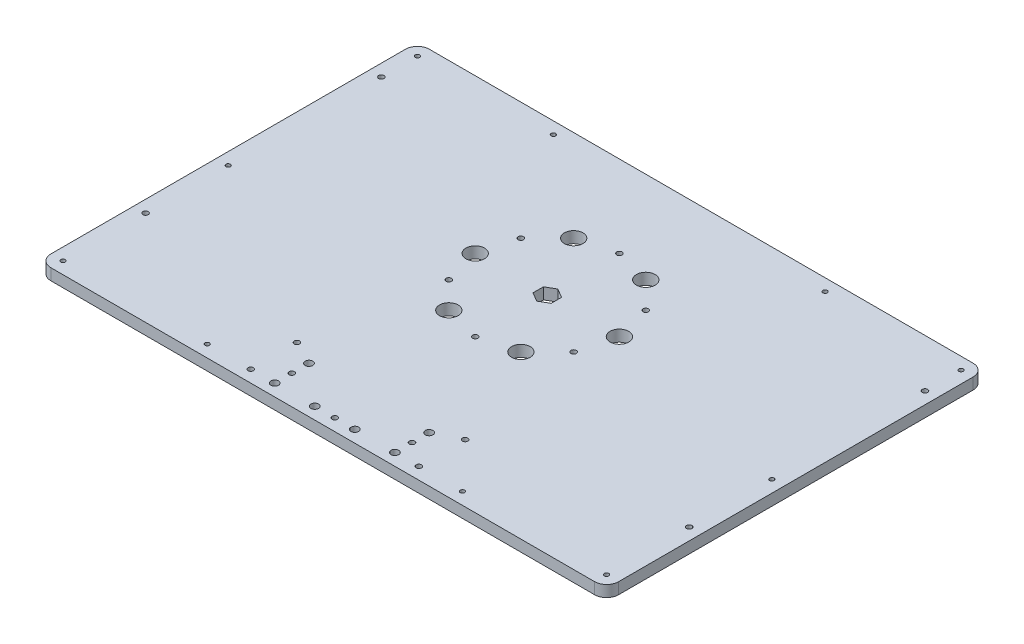
from build123d import *

# Parameters (mm, degrees)
SKETCH1_W            = 300
SKETCH1_H            = 200
BOSS_EXTRUDE1_DEPTH  = 6
SKETCH6_R            = 2.5
CUT_EXTRUDE2_DEPTH   = 361.605047108
FILLET1_R            = 6.35
SKETCH2_R            = 1.5
CUT_EXTRUDE1_DEPTH   = 361.605047108
SKETCH13_R           = 1.25
M3_TAP_DEPTH         = 364.853871767
SKETCH16_R           = 2.1
M5_TAP2_DEPTH        = 358.420816406
SKETCH9_R            = 1.5
CUT_EXTRUDE3_DEPTH   = 361.605047108
SKETCH10_R           = 1.5
CUT_EXTRUDE5_DEPTH   = 361.605047108
SKETCH17_R           = 5
M3_COUNTERBORE_DEPTH = 361.605047108
CUT_EXTRUDE6_DEPTH   = 361.605047108
MOVE_FACE1_BY        = 0.08
MOVE_FACE1_2_BY      = 0.08
MOVE_FACE1_3_BY      = 0.08
MOVE_FACE1_4_BY      = 0.08
MOVE_FACE1_5_BY      = 0.08
MOVE_FACE1_6_BY      = 0.08
MOVE_FACE1_7_BY      = 0.08
MOVE_FACE1_8_BY      = 0.08
MOVE_FACE1_9_BY      = 0.08
MOVE_FACE1_10_BY     = 0.08
MOVE_FACE1_11_BY     = 0.08
MOVE_FACE1_12_BY     = 0.08
MOVE_FACE1_13_BY     = 0.08
MOVE_FACE1_14_BY     = 0.08
MOVE_FACE1_15_BY     = 0.08
MOVE_FACE1_16_BY     = 0.08
MOVE_FACE1_17_BY     = 0.08
MOVE_FACE1_18_BY     = 0.08
MOVE_FACE1_19_BY     = 0.08
MOVE_FACE1_20_BY     = 0.08
MOVE_FACE1_21_BY     = 0.08
MOVE_FACE1_22_BY     = 0.08
MOVE_FACE1_23_BY     = 0.08
MOVE_FACE1_24_BY     = 0.08
MOVE_FACE1_25_BY     = 0.08
MOVE_FACE1_26_BY     = 0.08
MOVE_FACE1_27_BY     = 0.08
MOVE_FACE1_28_BY     = 0.08
MOVE_FACE1_29_BY     = 0.08
MOVE_FACE1_30_BY     = 0.08
MOVE_FACE1_31_BY     = 0.08
MOVE_FACE1_32_BY     = 0.08
MOVE_FACE1_33_BY     = 0.08
MOVE_FACE1_34_BY     = 0.08
MOVE_FACE1_35_BY     = 0.08
MOVE_FACE1_36_BY     = 0.08
MOVE_FACE1_37_BY     = 0.08
MOVE_FACE1_38_BY     = 0.08
MOVE_FACE1_39_BY     = 0.08


with BuildPart() as part:
    # Sketch1 → Boss-Extrude1 (new body)
    with BuildSketch(Plane(origin=(0, 0, 0), x_dir=(1, 0, 0), z_dir=(0, 1, 0))):
        with Locations((150, 100)):
            Rectangle(SKETCH1_W, SKETCH1_H)
    extrude(amount=BOSS_EXTRUDE1_DEPTH)

    # Sketch6 → Cut-Extrude2 (cut, through all)
    with BuildSketch(Plane(origin=(0, 6, 0), x_dir=(1, 0, 0), z_dir=(0, 1, 0))):
        with Locations(Location((150, 118.65102, 0), (0, 0, 270))):
            Circle(SKETCH6_R)
    extrude(amount=-CUT_EXTRUDE2_DEPTH, mode=Mode.SUBTRACT)

    # Fillet1
    fillet1_edges = [part.edges().sort_by_distance(p)[0] for p in [
        (0, 3, -200),
        (300, 3, -200),
        (300, 3, 0),
        (0, 3, 0),
    ]]
    fillet(fillet1_edges, radius=FILLET1_R)

    # Sketch2 → Cut-Extrude1 (cut, through all)
    with BuildSketch(Plane(origin=(0, 6, 0), x_dir=(1, 0, 0), z_dir=(0, 1, 0))):
        with Locations(Location((6.35, 174.6, 0), (0, 0, 270))):
            Circle(SKETCH2_R)
        with Locations(Location((6.35, 49.9999, 0), (0, 0, 270))):
            Circle(SKETCH2_R)
        with Locations(Location((293.65, 49.9999, 0), (0, 0, 270))):
            Circle(SKETCH2_R)
        with Locations(Location((293.65, 174.6, 0), (0, 0, 270))):
            Circle(SKETCH2_R)
    extrude(amount=-CUT_EXTRUDE1_DEPTH, mode=Mode.SUBTRACT)

    # Sketch13 → M3-tap (cut, through all)
    with BuildSketch(Plane(origin=(0, 6, 5.8), x_dir=(1, 0, 0), z_dir=(0, 1, 0))):
        with Locations(Location((6.35, 199.45, 0), (0, 0, 270))):
            Circle(SKETCH13_R)
        with Locations(Location((78.175, 199.45, 0), (0, 0, 270))):
            Circle(SKETCH13_R)
        with Locations(Location((221.825, 199.45, 0), (0, 0, 270))):
            Circle(SKETCH13_R)
        with Locations(Location((293.65, 199.45, 0), (0, 0, 270))):
            Circle(SKETCH13_R)
        with Locations(Location((293.65, 99.4498, 0), (0, 0, 270))):
            Circle(SKETCH13_R)
        with Locations(Location((293.65, 12.15, 0), (0, 0, 270))):
            Circle(SKETCH13_R)
        with Locations(Location((217.45, 12.15, 0), (0, 0, 270))):
            Circle(SKETCH13_R)
        with Locations(Location((82.55, 12.15, 0), (0, 0, 270))):
            Circle(SKETCH13_R)
        with Locations(Location((6.35, 12.15, 0), (0, 0, 270))):
            Circle(SKETCH13_R)
        with Locations(Location((6.35, 99.4498, 0), (0, 0, 270))):
            Circle(SKETCH13_R)
    extrude(amount=-M3_TAP_DEPTH, mode=Mode.SUBTRACT)

    # Sketch16 → M5-tap2 (cut, through all)
    with BuildSketch(Plane(origin=(0, 6, -5.8), x_dir=(1, 0, 0), z_dir=(0, -1, 0))):
        with Locations(Location((118.25, -18.65102, 0), (0, 0, 270))):
            Circle(SKETCH16_R)
        with Locations(Location((118.25, -0.55098, 0), (0, 0, 270))):
            Circle(SKETCH16_R)
        with Locations(Location((139.416666667, -0.55098, 0), (0, 0, 270))):
            Circle(SKETCH16_R)
        with Locations(Location((160.583333333, -0.55098, 0), (0, 0, 270))):
            Circle(SKETCH16_R)
        with Locations(Location((181.75, -0.55098, 0), (0, 0, 270))):
            Circle(SKETCH16_R)
        with Locations(Location((181.75, -18.65102, 0), (0, 0, 270))):
            Circle(SKETCH16_R)
    extrude(amount=M5_TAP2_DEPTH, mode=Mode.SUBTRACT)

    # Sketch9 → Cut-Extrude3 (cut, through all)
    with BuildSketch(Plane(origin=(0, 6, 0), x_dir=(-1, 0, 0), z_dir=(0, 1, 0))):
        with Locations(Location((-118.25, -15.401, 0), (0, 0, 90))):
            Circle(SKETCH9_R)
        with Locations(Location((-150, -6.35098, 0), (0, 0, 90))):
            Circle(SKETCH9_R)
        with Locations(Location((-181.75, -15.401, 0), (0, 0, 90))):
            Circle(SKETCH9_R)
    extrude(amount=-CUT_EXTRUDE3_DEPTH, mode=Mode.SUBTRACT)

    # Sketch10 → Cut-Extrude5 (cut, through all)
    with BuildSketch(Plane(origin=(0, 6, 0), x_dir=(1, 0, 0), z_dir=(0, 1, 0))):
        with Locations(Location((150, 156.75102, 0), (0, 0, 270))):
            Circle(SKETCH10_R)
        with Locations(Location((182.995567884, 137.70102, 0), (0, 0, 270))):
            Circle(SKETCH10_R)
        with Locations(Location((182.995567884, 99.60102, 0), (0, 0, 270))):
            Circle(SKETCH10_R)
        with Locations(Location((150, 80.55102, 0), (0, 0, 270))):
            Circle(SKETCH10_R)
        with Locations(Location((117.004432116, 99.60102, 0), (0, 0, 270))):
            Circle(SKETCH10_R)
        with Locations(Location((117.004432116, 137.70102, 0), (0, 0, 270))):
            Circle(SKETCH10_R)
        with Locations(Location((105.55, 30.80102, 0), (0, 0, 270))):
            Circle(SKETCH10_R)
        with Locations(Location((105.55, 6.35, 0), (0, 0, 270))):
            Circle(SKETCH10_R)
        with Locations(Location((194.45, 6.35, 0), (0, 0, 90))):
            Circle(SKETCH10_R)
        with Locations(Location((194.45, 30.80102, 0), (0, 0, 90))):
            Circle(SKETCH10_R)
    extrude(amount=-CUT_EXTRUDE5_DEPTH, mode=Mode.SUBTRACT)

    # Sketch17 → M3_counterbore (cut, through all)
    with BuildSketch(Plane(origin=(0, 6, 0), x_dir=(1, 0, 0), z_dir=(0, 1, 0))):
        with Locations(Location((188.1, 118.65102, 0), (0, 0, 270))):
            Circle(SKETCH17_R)
        with Locations(Location((169.05, 85.655452116, 0), (0, 0, 270))):
            Circle(SKETCH17_R)
        with Locations(Location((130.95, 85.655452116, 0), (0, 0, 270))):
            Circle(SKETCH17_R)
        with Locations(Location((111.9, 118.65102, 0), (0, 0, 270))):
            Circle(SKETCH17_R)
        with Locations(Location((130.95, 151.646587884, 0), (0, 0, 270))):
            Circle(SKETCH17_R)
        with Locations(Location((169.05, 151.646587884, 0), (0, 0, 270))):
            Circle(SKETCH17_R)
    extrude(amount=-M3_COUNTERBORE_DEPTH, mode=Mode.SUBTRACT)

    # Sketch18 → Cut-Extrude6 (cut, through all)
    with BuildSketch(Plane(origin=(0, 6, 0), x_dir=(1, 0, 0), z_dir=(0, 1, 0))):
        Polygon((154.8, 121.422301292), (154.8, 115.879738708), (150, 113.108457416), (145.2, 115.879738708), (145.2, 121.422301292), (150, 124.193582584), align=None)
    extrude(amount=-CUT_EXTRUDE6_DEPTH, mode=Mode.SUBTRACT)

    # Move Face1: a curved face moved outward by 0.08
    add(Solid.thicken(part.faces().sort_by_distance((111.9, 3, -123.65102))[0], MOVE_FACE1_BY))

    # Move Face1 2: a curved face moved outward by 0.08
    add(Solid.thicken(part.faces().sort_by_distance((6.35, 3, -176.1))[0], MOVE_FACE1_2_BY))

    # Move Face1 3: a curved face moved outward by 0.08
    add(Solid.thicken(part.faces().sort_by_distance((6.35, 3, -51.4999))[0], MOVE_FACE1_3_BY))

    # Move Face1 4: a curved face moved outward by 0.08
    add(Solid.thicken(part.faces().sort_by_distance((293.65, 3, -51.4999))[0], MOVE_FACE1_4_BY))

    # Move Face1 5: a curved face moved outward by 0.08
    add(Solid.thicken(part.faces().sort_by_distance((293.65, 3, -176.1))[0], MOVE_FACE1_5_BY))

    # Move Face1 6: a curved face moved outward by 0.08
    add(Solid.thicken(part.faces().sort_by_distance((6.35, 3, -194.9))[0], MOVE_FACE1_6_BY))

    # Move Face1 7: a curved face moved outward by 0.08
    add(Solid.thicken(part.faces().sort_by_distance((78.175, 3, -194.9))[0], MOVE_FACE1_7_BY))

    # Move Face1 8: a curved face moved outward by 0.08
    add(Solid.thicken(part.faces().sort_by_distance((221.825, 3, -194.9))[0], MOVE_FACE1_8_BY))

    # Move Face1 9: a curved face moved outward by 0.08
    add(Solid.thicken(part.faces().sort_by_distance((293.65, 3, -194.9))[0], MOVE_FACE1_9_BY))

    # Move Face1 10: a curved face moved outward by 0.08
    add(Solid.thicken(part.faces().sort_by_distance((293.65, 3, -94.8998))[0], MOVE_FACE1_10_BY))

    # Move Face1 11: a curved face moved outward by 0.08
    add(Solid.thicken(part.faces().sort_by_distance((293.65, 3, -7.6))[0], MOVE_FACE1_11_BY))

    # Move Face1 12: a curved face moved outward by 0.08
    add(Solid.thicken(part.faces().sort_by_distance((217.45, 3, -7.6))[0], MOVE_FACE1_12_BY))

    # Move Face1 13: a curved face moved outward by 0.08
    add(Solid.thicken(part.faces().sort_by_distance((82.55, 3, -7.6))[0], MOVE_FACE1_13_BY))

    # Move Face1 14: a curved face moved outward by 0.08
    add(Solid.thicken(part.faces().sort_by_distance((6.35, 3, -7.6))[0], MOVE_FACE1_14_BY))

    # Move Face1 15: a curved face moved outward by 0.08
    add(Solid.thicken(part.faces().sort_by_distance((6.35, 3, -94.8998))[0], MOVE_FACE1_15_BY))

    # Move Face1 16: a curved face moved outward by 0.08
    add(Solid.thicken(part.faces().sort_by_distance((118.25, 3, -22.35102))[0], MOVE_FACE1_16_BY))

    # Move Face1 17: a curved face moved outward by 0.08
    add(Solid.thicken(part.faces().sort_by_distance((118.25, 3, -4.25098))[0], MOVE_FACE1_17_BY))

    # Move Face1 18: a curved face moved outward by 0.08
    add(Solid.thicken(part.faces().sort_by_distance((139.416666667, 3, -4.25098))[0], MOVE_FACE1_18_BY))

    # Move Face1 19: a curved face moved outward by 0.08
    add(Solid.thicken(part.faces().sort_by_distance((160.583333333, 3, -4.25098))[0], MOVE_FACE1_19_BY))

    # Move Face1 20: a curved face moved outward by 0.08
    add(Solid.thicken(part.faces().sort_by_distance((181.75, 3, -4.25098))[0], MOVE_FACE1_20_BY))

    # Move Face1 21: a curved face moved outward by 0.08
    add(Solid.thicken(part.faces().sort_by_distance((181.75, 3, -22.35102))[0], MOVE_FACE1_21_BY))

    # Move Face1 22: a curved face moved outward by 0.08
    add(Solid.thicken(part.faces().sort_by_distance((118.25, 3, -16.901))[0], MOVE_FACE1_22_BY))

    # Move Face1 23: a curved face moved outward by 0.08
    add(Solid.thicken(part.faces().sort_by_distance((150, 3, -7.85098))[0], MOVE_FACE1_23_BY))

    # Move Face1 24: a curved face moved outward by 0.08
    add(Solid.thicken(part.faces().sort_by_distance((181.75, 3, -16.901))[0], MOVE_FACE1_24_BY))

    # Move Face1 25: a curved face moved outward by 0.08
    add(Solid.thicken(part.faces().sort_by_distance((150, 3, -158.25102))[0], MOVE_FACE1_25_BY))

    # Move Face1 26: a curved face moved outward by 0.08
    add(Solid.thicken(part.faces().sort_by_distance((182.995567884, 3, -139.20102))[0], MOVE_FACE1_26_BY))

    # Move Face1 27: a curved face moved outward by 0.08
    add(Solid.thicken(part.faces().sort_by_distance((182.995567884, 3, -101.10102))[0], MOVE_FACE1_27_BY))

    # Move Face1 28: a curved face moved outward by 0.08
    add(Solid.thicken(part.faces().sort_by_distance((150, 3, -82.05102))[0], MOVE_FACE1_28_BY))

    # Move Face1 29: a curved face moved outward by 0.08
    add(Solid.thicken(part.faces().sort_by_distance((117.004432116, 3, -101.10102))[0], MOVE_FACE1_29_BY))

    # Move Face1 30: a curved face moved outward by 0.08
    add(Solid.thicken(part.faces().sort_by_distance((117.004432116, 3, -139.20102))[0], MOVE_FACE1_30_BY))

    # Move Face1 31: a curved face moved outward by 0.08
    add(Solid.thicken(part.faces().sort_by_distance((105.55, 3, -32.30102))[0], MOVE_FACE1_31_BY))

    # Move Face1 32: a curved face moved outward by 0.08
    add(Solid.thicken(part.faces().sort_by_distance((105.55, 3, -7.85))[0], MOVE_FACE1_32_BY))

    # Move Face1 33: a curved face moved outward by 0.08
    add(Solid.thicken(part.faces().sort_by_distance((194.45, 3, -4.85))[0], MOVE_FACE1_33_BY))

    # Move Face1 34: a curved face moved outward by 0.08
    add(Solid.thicken(part.faces().sort_by_distance((194.45, 3, -29.30102))[0], MOVE_FACE1_34_BY))

    # Move Face1 35: a curved face moved outward by 0.08
    add(Solid.thicken(part.faces().sort_by_distance((188.1, 3, -123.65102))[0], MOVE_FACE1_35_BY))

    # Move Face1 36: a curved face moved outward by 0.08
    add(Solid.thicken(part.faces().sort_by_distance((169.05, 3, -90.655452116))[0], MOVE_FACE1_36_BY))

    # Move Face1 37: a curved face moved outward by 0.08
    add(Solid.thicken(part.faces().sort_by_distance((130.95, 3, -90.655452116))[0], MOVE_FACE1_37_BY))

    # Move Face1 38: a curved face moved outward by 0.08
    add(Solid.thicken(part.faces().sort_by_distance((130.95, 3, -156.646587884))[0], MOVE_FACE1_38_BY))

    # Move Face1 39: a curved face moved outward by 0.08
    add(Solid.thicken(part.faces().sort_by_distance((169.05, 3, -156.646587884))[0], MOVE_FACE1_39_BY))


solid = part.part
